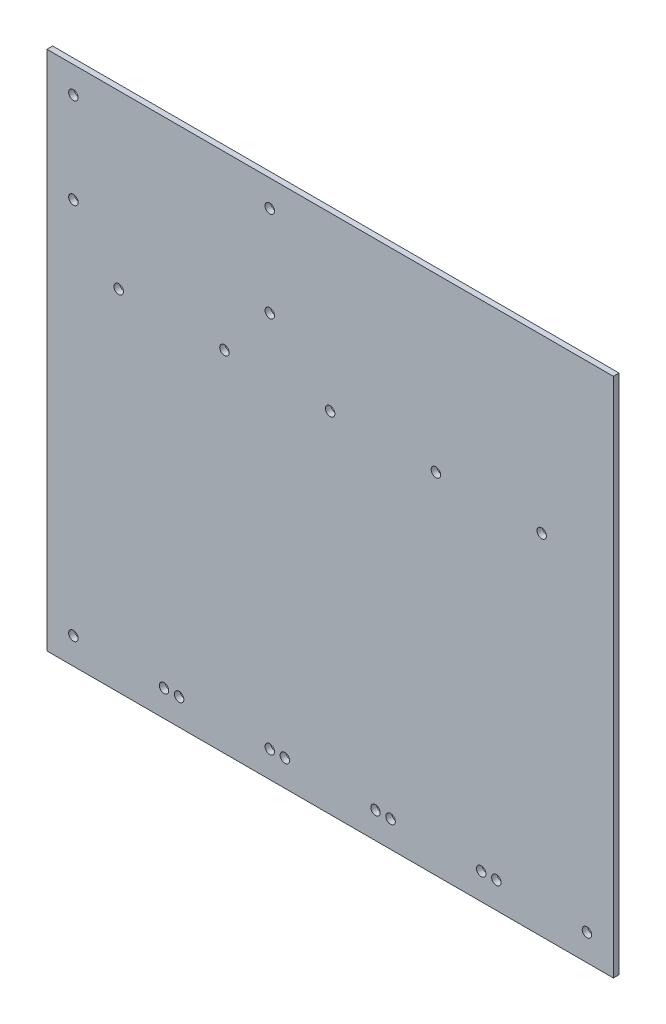
from build123d import *

# Parameters (mm, degrees)
SKETCH1_W           = 280
SKETCH1_H           = 200
SKETCH1_R           = 2.5
BOSS_EXTRUDE1_DEPTH = 3
SKETCH3_W           = 10
SKETCH3_H           = 200
BOSS_EXTRUDE2_DEPTH = 3
SKETCH4_W           = 300
SKETCH4_H           = 10
BOSS_EXTRUDE3_DEPTH = 3
SKETCH5_W           = 300
SKETCH5_H           = 66
SKETCH5_R           = 2.5
BOSS_EXTRUDE4_DEPTH = 3


with BuildPart() as part:
    # Sketch1 → Boss-Extrude1 (new body)
    with BuildSketch(Plane.XY):
        with Locations((28, 100)):
            Rectangle(SKETCH1_W, SKETCH1_H)
        with Locations((-108, 4)):
            Circle(SKETCH1_R, mode=Mode.SUBTRACT)
        with Locations((-60, 4)):
            Circle(SKETCH1_R, mode=Mode.SUBTRACT)
        with Locations((-52, 4)):
            Circle(SKETCH1_R, mode=Mode.SUBTRACT)
        with Locations((-4, 4)):
            Circle(SKETCH1_R, mode=Mode.SUBTRACT)
        with Locations((4, 4)):
            Circle(SKETCH1_R, mode=Mode.SUBTRACT)
        with Locations((52, 4)):
            Circle(SKETCH1_R, mode=Mode.SUBTRACT)
        with Locations((60, 4)):
            Circle(SKETCH1_R, mode=Mode.SUBTRACT)
        with Locations((108, 4)):
            Circle(SKETCH1_R, mode=Mode.SUBTRACT)
        with Locations((116, 4)):
            Circle(SKETCH1_R, mode=Mode.SUBTRACT)
        with Locations((164, 4)):
            Circle(SKETCH1_R, mode=Mode.SUBTRACT)
        with Locations((140, 175)):
            Circle(SKETCH1_R, mode=Mode.SUBTRACT)
        with Locations((84, 175)):
            Circle(SKETCH1_R, mode=Mode.SUBTRACT)
        with Locations((28, 175)):
            Circle(SKETCH1_R, mode=Mode.SUBTRACT)
        with Locations((-28, 175)):
            Circle(SKETCH1_R, mode=Mode.SUBTRACT)
        with Locations((-84, 175)):
            Circle(SKETCH1_R, mode=Mode.SUBTRACT)
    extrude(amount=BOSS_EXTRUDE1_DEPTH)

    # Sketch3 → Boss-Extrude2 (add)
    with BuildSketch(Plane.XY.offset(3)):
        with Locations((-117, 100)):
            Rectangle(SKETCH3_W, SKETCH3_H)
        with Locations((173, 100)):
            Rectangle(SKETCH3_W, SKETCH3_H)
    extrude(amount=-BOSS_EXTRUDE2_DEPTH)

    # Sketch4 → Boss-Extrude3 (add)
    with BuildSketch(Plane.XY.offset(3)):
        with Locations((28, -5)):
            Rectangle(SKETCH4_W, SKETCH4_H)
    extrude(amount=-BOSS_EXTRUDE3_DEPTH)

    # Sketch5 → Boss-Extrude4 (add)
    with BuildSketch(Plane.XY.offset(3)):
        with Locations((28, 233)):
            Rectangle(SKETCH5_W, SKETCH5_H)
        with Locations((-4, 204)):
            Circle(SKETCH5_R, mode=Mode.SUBTRACT)
        with Locations((-4, 252)):
            Circle(SKETCH5_R, mode=Mode.SUBTRACT)
        with Locations((-108, 252)):
            Circle(SKETCH5_R, mode=Mode.SUBTRACT)
        with Locations((-108, 204)):
            Circle(SKETCH5_R, mode=Mode.SUBTRACT)
    extrude(amount=-BOSS_EXTRUDE4_DEPTH)


solid = part.part
